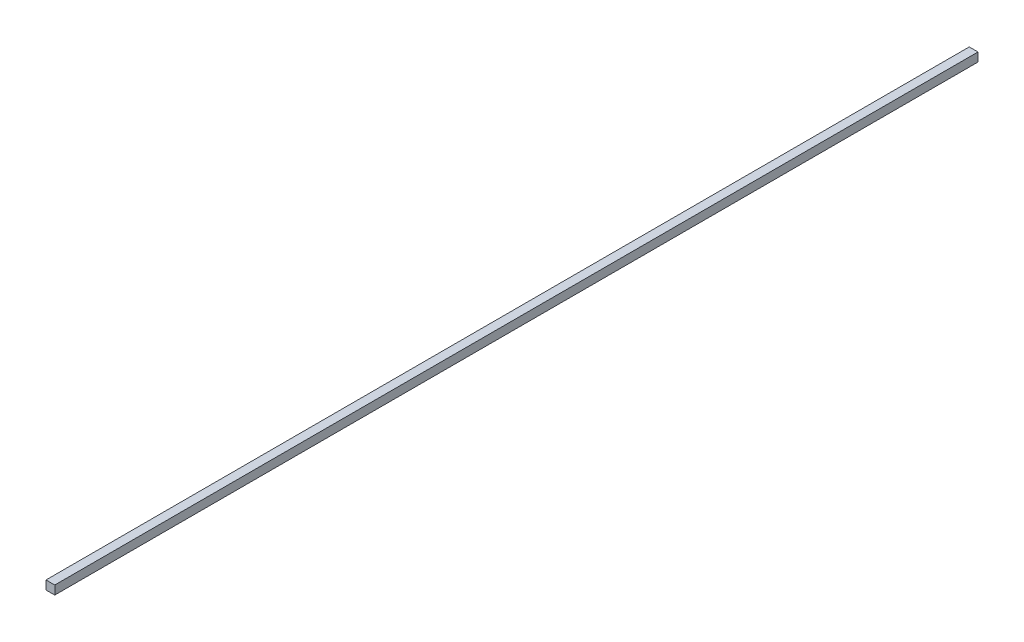
from build123d import *

# Parameters (mm, degrees)
SKETCH1_W           = 2
SKETCH1_H           = 2
BOSS_EXTRUDE1_DEPTH = 211


with BuildPart() as part:
    # Sketch1 → Boss-Extrude1 (new body)
    with BuildSketch(Plane.XY):
        with Locations((-1, -42.639084956)):
            Rectangle(SKETCH1_W, SKETCH1_H)
    extrude(amount=BOSS_EXTRUDE1_DEPTH)


solid = part.part
